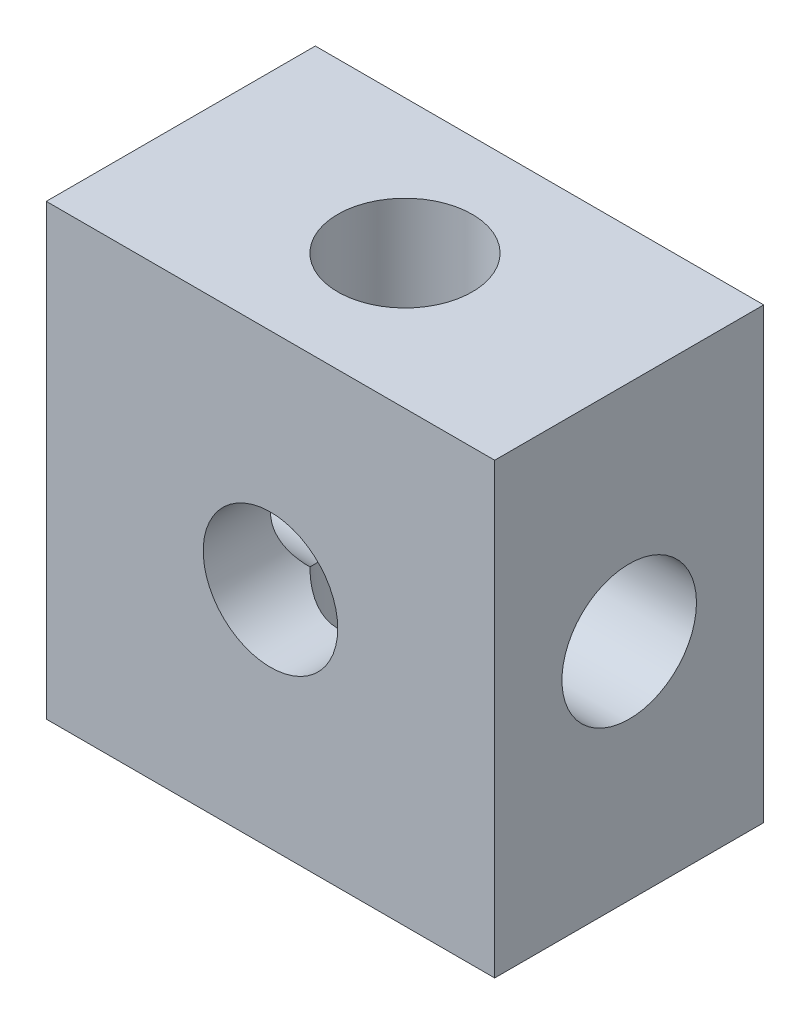
from build123d import *

# Parameters (mm, degrees)
SKETCH_1_W          = 10
SKETCH_1_H          = 10
EXTRUDE_1_DEPTH     = 6
SKETCH_2_R          = 1.5
CUT_EXTRUDE_1_DEPTH = 10.273618495
SKETCH_3_R          = 1.5
CUT_EXTRUDE_2_DEPTH = 13.68857754
SKETCH_4_R          = 1.5
CUT_EXTRUDE_3_DEPTH = 13.68857754


with BuildPart() as part:
    # 草图1 → 凸台-拉伸1 (new body)
    with BuildSketch(Plane.XY):
        Rectangle(SKETCH_1_W, SKETCH_1_H)
    extrude(amount=EXTRUDE_1_DEPTH)

    # 草图2 → 切除-拉伸1 (cut, through all)
    with BuildSketch(Plane.XY.offset(6)):
        Circle(SKETCH_2_R)
    extrude(amount=-CUT_EXTRUDE_1_DEPTH, mode=Mode.SUBTRACT)

    # 草图3 → 切除-拉伸2 (cut, through all)
    with BuildSketch(Plane(origin=(0, 5, 0), x_dir=(1, 0, 0), z_dir=(0, 1, 0))):
        with Locations(Location((0, -3, 0), (0, 0, 180))):
            Circle(SKETCH_3_R)
    extrude(amount=-CUT_EXTRUDE_2_DEPTH, mode=Mode.SUBTRACT)

    # 草图4 → 切除-拉伸3 (cut, through all)
    with BuildSketch(Plane(origin=(5, 0, 0), x_dir=(0, 0, -1), z_dir=(1, 0, 0))):
        with Locations((-3, 0)):
            Circle(SKETCH_4_R)
    extrude(amount=-CUT_EXTRUDE_3_DEPTH, mode=Mode.SUBTRACT)


solid = part.part
